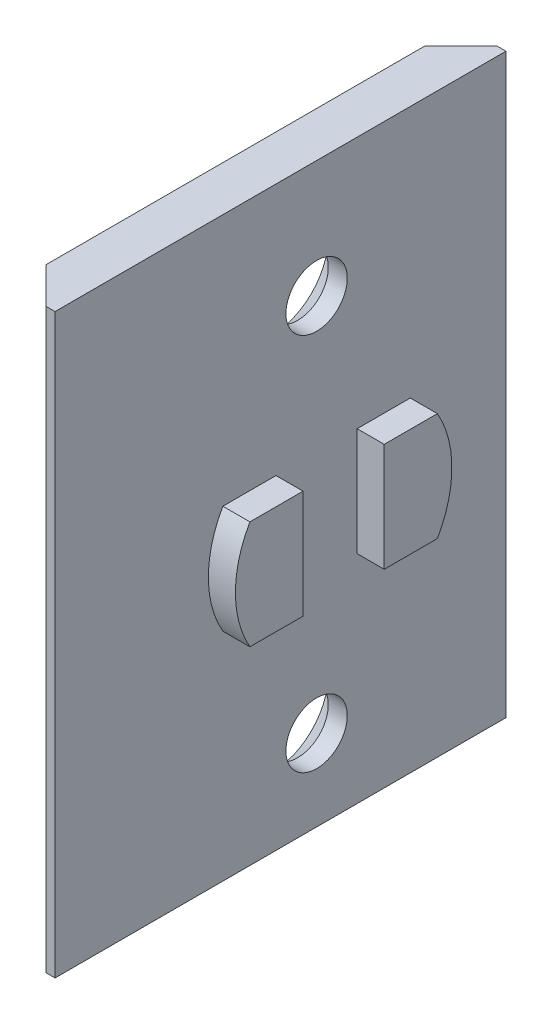
from build123d import *

# Parameters (mm, degrees)
SKETCH_1_W                 = 25
SKETCH_1_H                 = 32
EXTRUDE_1_DEPTH            = 2.5
CHAMFER_1_SIZE             = 2
HOLE_WIZARD_M31_AT_2_COUNT = 2
HOLE_WIZARD_M31_AT_2_PITCH = 21
SKETCH_4_R                 = 6
SKETCH_4_R_2               = 3.5
EXTRUDE_2_DEPTH            = 1.5
SKETCH_5_W                 = 4.5
SKETCH_5_H                 = 16
CUT_EXTRUDE_1_DEPTH        = 1.5
CUT_EXTRUDE_START          = -1.5
CUT_EXTRUDE_2_DEPTH        = 1.5


with BuildPart() as part:
    # Эскиз1 → Бобышка-Вытянуть1 (new body)
    with BuildSketch(Plane(origin=(0, 0, 0), x_dir=(0, 0, -1), z_dir=(1, 0, 0))):
        Rectangle(SKETCH_1_W, SKETCH_1_H)
    extrude(amount=EXTRUDE_1_DEPTH)

    # Фаска1
    chamfer_1_edges = [part.edges().sort_by_distance(p)[0] for p in [
        (0, 0, 12.5),
        (0, 0, -12.5),
    ]]
    chamfer(chamfer_1_edges, length=CHAMFER_1_SIZE)

    # Эскиз3 → Зенковка для  винта с плоской головкой M31 (revolve, cut)
    with BuildSketch(Plane(origin=(0, -11.5, -2), x_dir=(0, 0, 1), z_dir=(0, 1, 0))):
        Polygon((0, 0), (0, 2.5), (1.7, 2.5), (1.7, 1.45), (3.15, 0), align=None)
    hole_wizard_m31 = revolve(axis=Axis((-6.35, -11.5, -2), (1, 0, 0)), mode=Mode.SUBTRACT)

    # Зенковка для  винта с плоской головкой M31 at 2: Зенковка для  винта с плоской головкой M31 ×2
    with Locations(*[(0, i * HOLE_WIZARD_M31_AT_2_PITCH, 0) for i in range(1, HOLE_WIZARD_M31_AT_2_COUNT)]):
        add(hole_wizard_m31, mode=Mode.SUBTRACT)

    # Эскиз4 → Бобышка-Вытянуть2 (add)
    # profile 1 of 3: a face of its own
    with BuildSketch(Plane(origin=(2.5, 0, 0), x_dir=(0, 0, -1), z_dir=(1, 0, 0))):
        with Locations(Location((2, -1, 0), (0, 0, 180))):
            Circle(SKETCH_4_R)
        with Locations((2, -1)):
            Circle(SKETCH_4_R_2, mode=Mode.SUBTRACT)
    # profile 2 of 3: a face of its own
    with BuildSketch(Plane(origin=(2.5, 0, 0), x_dir=(0, 0, -1), z_dir=(1, 0, 0))):
        with BuildLine():
            ThreePointArc((-0.25, 1.680951324), (-1.5, -1), (-0.25, -3.680951324))
            Line((-0.25, -3.680951324), (-0.25, 1.680951324))
        make_face()
    # profile 3 of 3: a face of its own
    with BuildSketch(Plane(origin=(2.5, 0, 0), x_dir=(0, 0, -1), z_dir=(1, 0, 0))):
        with BuildLine():
            Line((4.25, 1.680951324), (4.25, -3.680951324))
            ThreePointArc((4.25, -3.680951324), (5.172144385, -2.479019946), (5.5, -1))
            ThreePointArc((5.5, -1), (5.172144385, 0.479019946), (4.25, 1.680951324))
        make_face()
    extrude(amount=EXTRUDE_2_DEPTH)

    # Эскиз5 → Вырез-Вытянуть1 (cut)
    with BuildSketch(Plane(origin=(4, 0, 0), x_dir=(0, 0, -1), z_dir=(1, 0, 0))):
        with Locations((2, -1)):
            Rectangle(SKETCH_5_W, SKETCH_5_H)
    extrude(amount=-CUT_EXTRUDE_1_DEPTH, mode=Mode.SUBTRACT)

    # Эскиз6 → Вырез-Вытянуть2 (cut)
    with BuildSketch(Plane(origin=(4, 0, 0), x_dir=(0, 0, -1), z_dir=(1, 0, 0)).offset(CUT_EXTRUDE_START)):
        with BuildLine():
            ThreePointArc((4.25, 4.562148865), (0.047794779, 4.67352578), (-3.196152423, 2))
            Line((-3.196152423, 2), (4.25, 2))
            Line((4.25, 2), (4.25, 4.562148865))
        make_face()
        with BuildLine():
            Line((4.25, 4.562148865), (4.25, 2))
            Line((4.25, 2), (7.196152423, 2))
            ThreePointArc((7.196152423, 2), (5.937314844, 3.527422205), (4.25, 4.562148865))
        make_face()
        with BuildLine():
            Line((4.25, -4), (-3.196152423, -4))
            ThreePointArc((-3.196152423, -4), (0.047794779, -6.67352578), (4.25, -6.562148865))
            Line((4.25, -6.562148865), (4.25, -4))
        make_face()
        with BuildLine():
            Line((7.196152423, -4), (4.25, -4))
            Line((4.25, -4), (4.25, -6.562148865))
            ThreePointArc((4.25, -6.562148865), (5.937314844, -5.527422205), (7.196152423, -4))
        make_face()
    extrude(amount=CUT_EXTRUDE_2_DEPTH, mode=Mode.SUBTRACT)


solid = part.part
